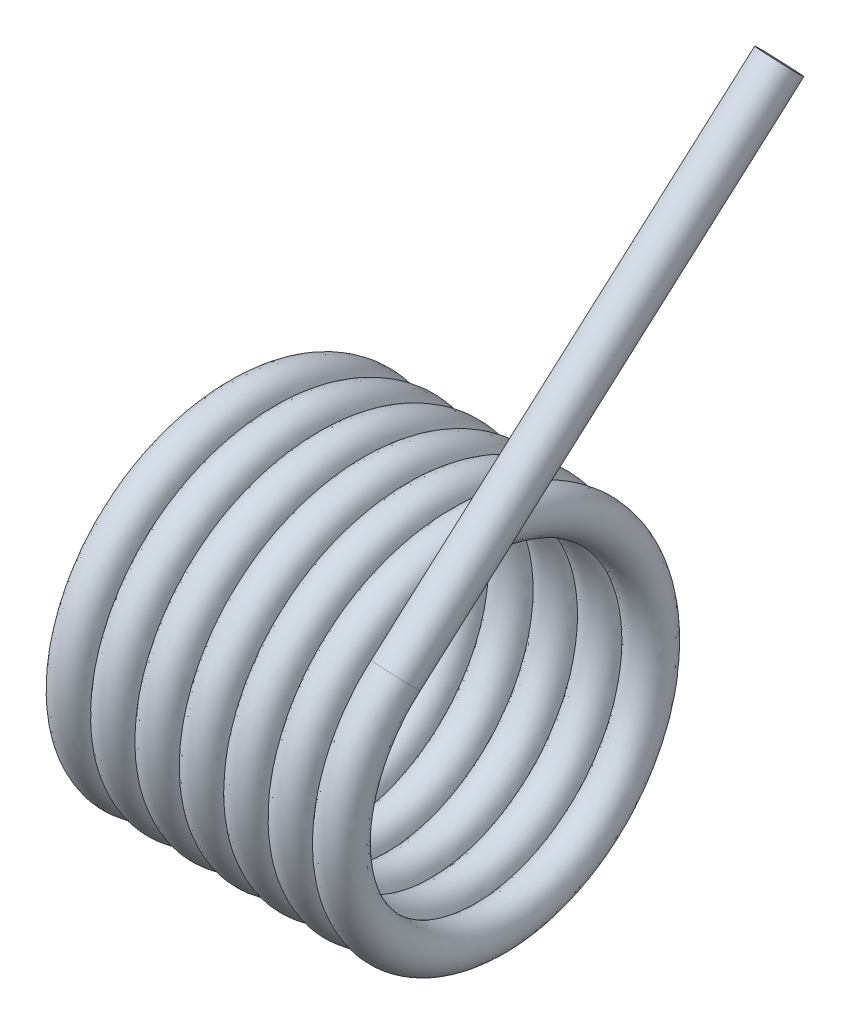
from build123d import *

# Parameters (mm, degrees)
SWEEP1_PITCH       = 0.3302
SWEEP1_HEIGHT      = 2.105025
SWEEP1_RADIUS      = 1.2319
SWEEP1_START_ANGLE = 90
SKETCH2_R          = 0.1524
SKETCH3_R          = 0.1524
EXTRUDE1_DEPTH     = 2.54
SKETCH4_R          = 0.1524
EXTRUDE2_DEPTH     = 3.81


with BuildPart() as part:
    # Sweep1: sweep along a helix
    with BuildLine() as sweep1_path:
        add(Helix(SWEEP1_PITCH, SWEEP1_HEIGHT, SWEEP1_RADIUS, center=(0, 0, 0), direction=(1, 0, 0), lefthand=True, mode=Mode.PRIVATE).rotate(Axis((0, 0, 0), (1, 0, 0)), SWEEP1_START_ANGLE))
    # Sketch2 → Sweep1 (sweep)
    with BuildSketch(Plane(origin=(0, -1.2319, 0), x_dir=(0.9990912985626407, 2.6806532356687372e-14, -0.042621322555927425), z_dir=(0.042621322555927425, -1.0817088978066005e-14, 0.9990912985626407))):
        Circle(SKETCH2_R)
    sweep(path=sweep1_path.line, is_frenet=True)

    # Sketch3 → Extrude1 (add)
    with BuildSketch(Plane(origin=(0, 0, 0), x_dir=(-0.9990912985626407, -2.677877944414561e-14, 0.04262132255592743), z_dir=(-0.04262132255592743, 1.0817088978066008e-14, -0.9990912985626407))):
        with Locations((0, -1.2319)):
            Circle(SKETCH3_R)
    extrude(amount=EXTRUDE1_DEPTH)

    # Sketch4 → Extrude2 (add)
    with BuildSketch(Plane(origin=(0.00382394, 0.063383229, -0.063383229), x_dir=(0.9919823221787042, -0.1141262767153525, -0.05427951223101079), z_dir=(0.0426213225559274, 0.7064642322380609, -0.7064642322381728))):
        with Locations(Location((1.941451857, -1.473574924, 0), (0, 0, 353.160939734))):
            Circle(SKETCH4_R)
    extrude(amount=EXTRUDE2_DEPTH)


solid = part.part
